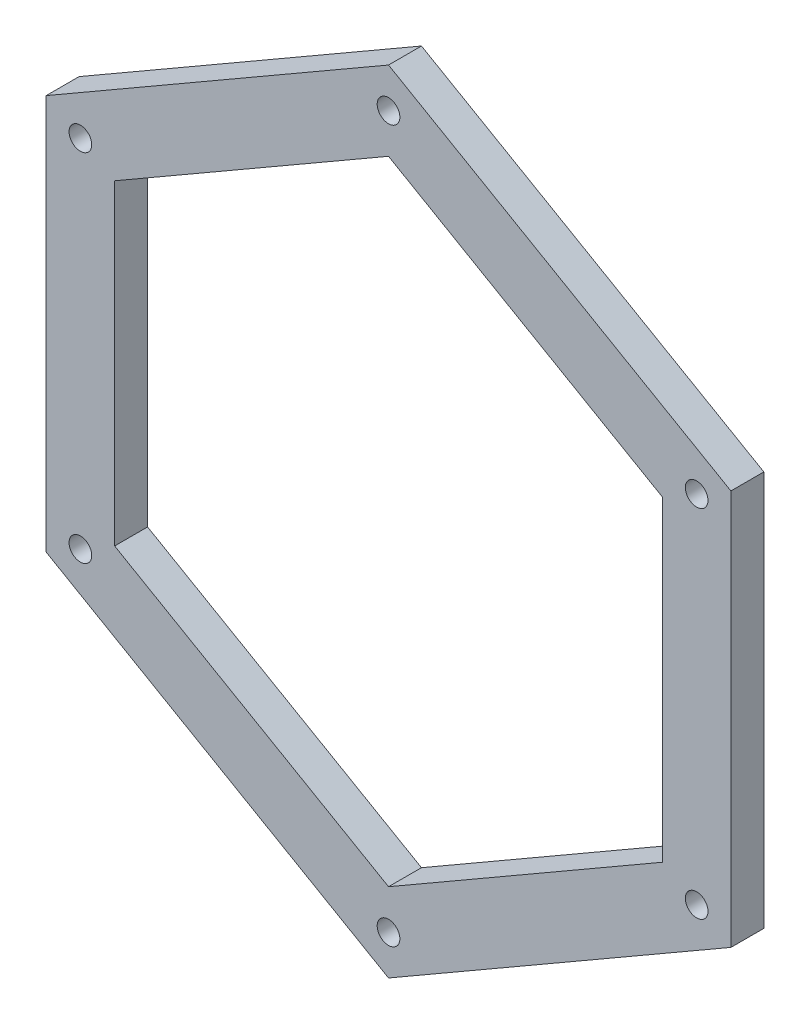
from build123d import *

# Parameters (mm, degrees)
SKETCH1_R           = 1.0922
BOSS_EXTRUDE1_DEPTH = 3.175


with BuildPart() as part:
    # Sketch1 → Boss-Extrude1 (new body)
    with BuildSketch(Plane.XY):
        Polygon((32.995567884, 19.05), (0, 38.1), (-32.995567884, 19.05), (-32.995567884, -19.05), (0, -38.1), (32.995567884, -19.05), align=None)
        with Locations((-29.696011096, 17.145)):
            Circle(SKETCH1_R, mode=Mode.SUBTRACT)
        with Locations((0, 34.29)):
            Circle(SKETCH1_R, mode=Mode.SUBTRACT)
        with Locations((29.696011096, 17.145)):
            Circle(SKETCH1_R, mode=Mode.SUBTRACT)
        with Locations((29.696011096, -17.145)):
            Circle(SKETCH1_R, mode=Mode.SUBTRACT)
        with Locations((0, -34.29)):
            Circle(SKETCH1_R, mode=Mode.SUBTRACT)
        with Locations((-29.696011096, -17.145)):
            Circle(SKETCH1_R, mode=Mode.SUBTRACT)
        Polygon((26.396454307, 15.24), (0, 30.48), (-26.396454307, 15.24), (-26.396454307, -15.24), (0, -30.48), (26.396454307, -15.24), align=None, mode=Mode.SUBTRACT)
    extrude(amount=BOSS_EXTRUDE1_DEPTH)


solid = part.part
